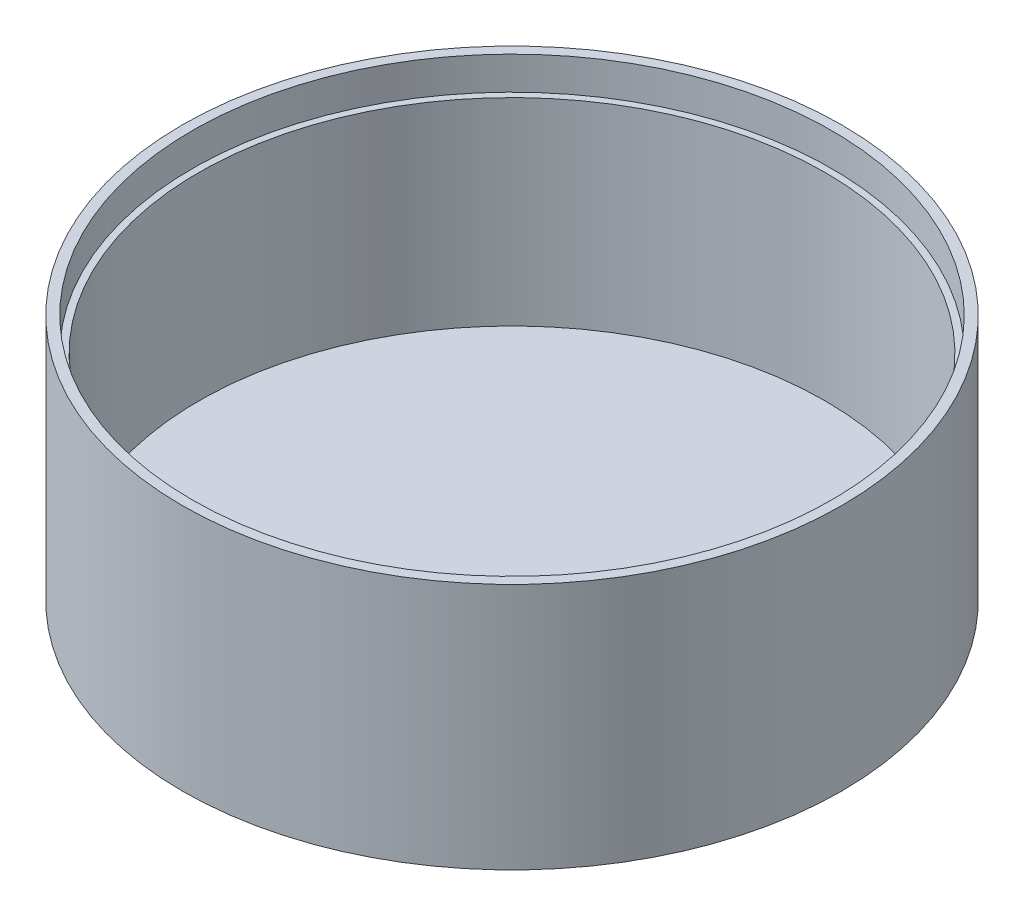
from build123d import *

# Parameters (mm, degrees)
SKETCH1_R           = 40
BOSS_EXTRUDE1_DEPTH = 30
SHELL1_T            = -2
SKETCH2_R           = 38.8
CUT_EXTRUDE1_DEPTH  = 4


with BuildPart() as part:
    # Sketch1 → Boss-Extrude1 (new body)
    with BuildSketch(Plane(origin=(0, 0, 0), x_dir=(1, 0, 0), z_dir=(0, 1, 0))):
        with Locations(Location((0, 0, 0), (0, 0, 270))):
            Circle(SKETCH1_R)
    extrude(amount=BOSS_EXTRUDE1_DEPTH)

    # Shell1
    shell1_openings = [part.faces().sort_by_distance(p)[0] for p in [
        (0, 30, 0),
    ]]
    offset(amount=SHELL1_T, openings=shell1_openings, kind=Kind.INTERSECTION)

    # Sketch2 → Cut-Extrude1 (cut)
    with BuildSketch(Plane(origin=(0, 30, 0), x_dir=(1, 0, 0), z_dir=(0, 1, 0))):
        with Locations(Location((0, 0, 0), (0, 0, 270))):
            Circle(SKETCH2_R)
    extrude(amount=-CUT_EXTRUDE1_DEPTH, mode=Mode.SUBTRACT)


solid = part.part
